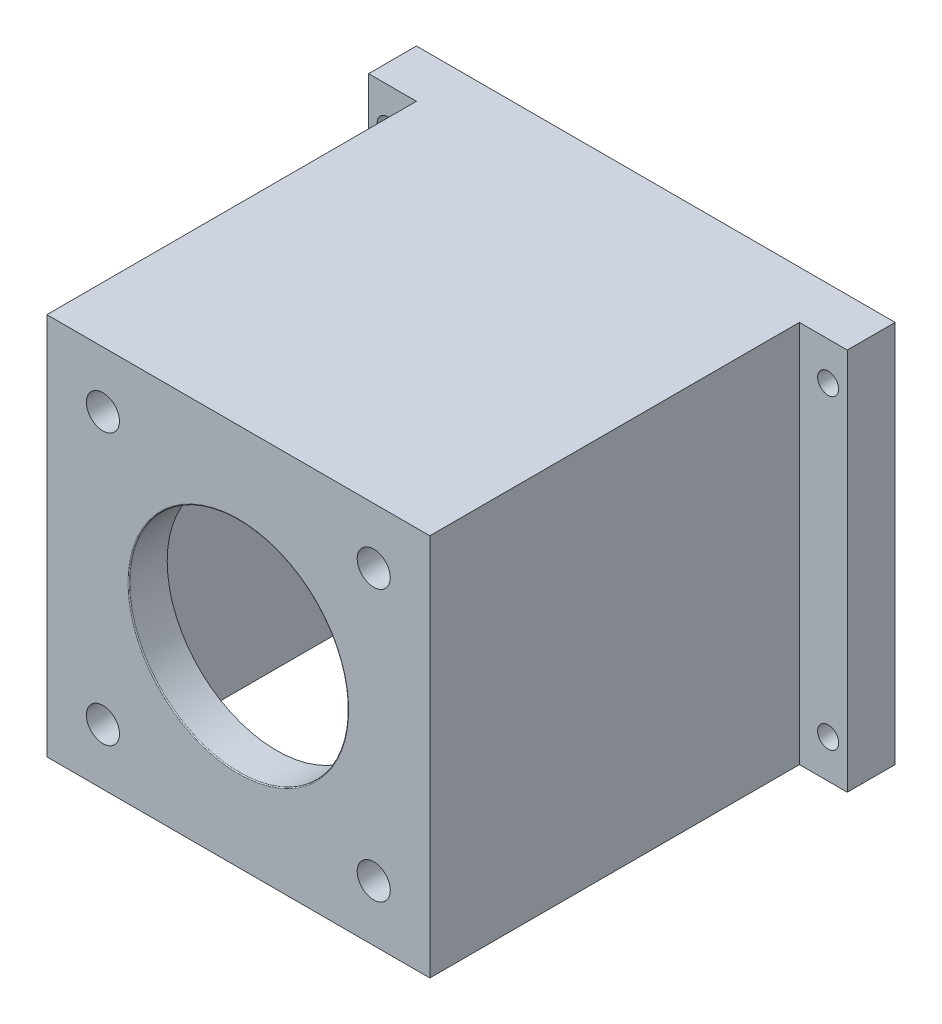
from build123d import *

# Parameters (mm, degrees)
SKETCH_1_W           = 200
SKETCH_1_H           = 200
EXTRUDE_1_DEPTH      = 191
SHELL_1_T            = -20
SKETCH_4_5_R         = 51
CUT_EXTRUDE_6_DEPTH  = 191
SKETCH_4_R           = 8.642247924
CUT_EXTRUDE_7_DEPTH  = 50
SKETCH_4_10_R        = 57.15
CUT_EXTRUDE_9_DEPTH  = 50
CUT_EXTRUDE_START    = -171
SKETCH_4_11_R        = 4
CUT_EXTRUDE_10_DEPTH = 50
SKETCH_9_W           = 200
SKETCH_9_H           = 200
EXTRUDE_3_DEPTH      = 32
SKETCH_10_R          = 72.5
CUT_EXTRUDE_11_DEPTH = 2
SKETCH_11_R          = 72
CUT_EXTRUDE_13_DEPTH = 30
SKETCH_11_3_W        = 200
SKETCH_11_3_H        = 200
SKETCH_11_3_R        = 77
CUT_EXTRUDE_14_DEPTH = 5
SKETCH_14_W          = 25
SKETCH_14_H          = 200
EXTRUDE_4_DEPTH      = 25
SKETCH_15_R          = 5.5
CUT_EXTRUDE_15_DEPTH = 25
SKETCH_16_R          = 3
CUT_EXTRUDE_16_DEPTH = 20
FILLET_1_R           = 0.5


with BuildPart() as part:
    # 草图1 → 凸台-拉伸1 (new body)
    with BuildSketch(Plane.XY):
        with Locations((43.238558972, -58.914961101)):
            Rectangle(SKETCH_1_W, SKETCH_1_H)
    extrude(amount=EXTRUDE_1_DEPTH)

    # 抽壳1
    shell_1_openings = [part.faces().sort_by_distance(p)[0] for p in [
        (43.238558972, -158.914961101, 95.5),
    ]]
    offset(amount=SHELL_1_T, openings=shell_1_openings, kind=Kind.INTERSECTION)

    # 草图4<5> → 切除-拉伸6 (cut)
    with BuildSketch(Plane.XY.offset(191)):
        with Locations((43.238558972, -58.914961101)):
            Circle(SKETCH_4_5_R)
    extrude(amount=-CUT_EXTRUDE_6_DEPTH, mode=Mode.SUBTRACT)

    # 草图4 → 切除-拉伸7 (cut)
    with BuildSketch(Plane.XY.offset(191)):
        with Locations((-27.472119147, 11.795717018)):
            Circle(SKETCH_4_R)
        with Locations((113.949237091, 11.795717018)):
            Circle(SKETCH_4_R)
        with Locations((113.949237091, -129.625639219)):
            Circle(SKETCH_4_R)
        with Locations((-27.472119147, -129.625639219)):
            Circle(SKETCH_4_R)
    extrude(amount=-CUT_EXTRUDE_7_DEPTH, mode=Mode.SUBTRACT)

    # 草图4<10> → 切除-拉伸9 (cut)
    with BuildSketch(Plane.XY.offset(191)):
        with Locations((43.238558972, -58.914961101)):
            Circle(SKETCH_4_10_R)
    extrude(amount=-CUT_EXTRUDE_9_DEPTH, mode=Mode.SUBTRACT)

    # 草图4<11> → 切除-拉伸10 (cut)
    with BuildSketch(Plane.XY.offset(191).offset(CUT_EXTRUDE_START)):
        with Locations(Location((-17.761441028, -58.914961101, 0), (0, 0, 180))):
            Circle(SKETCH_4_11_R)
        with Locations(Location((12.738558972, -6.08741147, 0), (0, 0, 180))):
            Circle(SKETCH_4_11_R)
        with Locations(Location((73.738558972, -6.08741147, 0), (0, 0, 180))):
            Circle(SKETCH_4_11_R)
        with Locations(Location((104.238558972, -58.914961101, 0), (0, 0, 180))):
            Circle(SKETCH_4_11_R)
        with Locations(Location((73.738558972, -111.742510731, 0), (0, 0, 180))):
            Circle(SKETCH_4_11_R)
        with Locations(Location((12.738558972, -111.742510731, 0), (0, 0, 180))):
            Circle(SKETCH_4_11_R)
    extrude(amount=-CUT_EXTRUDE_10_DEPTH, mode=Mode.SUBTRACT)

    # 草图9 → 凸台-拉伸3 (add)
    with BuildSketch(Plane(origin=(0, 0, 0), x_dir=(-1, 0, 0), z_dir=(0, 0, -1))):
        with Locations((-43.238558972, -58.914961101)):
            Rectangle(SKETCH_9_W, SKETCH_9_H)
    extrude(amount=EXTRUDE_3_DEPTH)

    # 草图10 → 切除-拉伸11 (cut)
    with BuildSketch(Plane.XY):
        with Locations((43.238558972, -57.634762562)):
            Circle(SKETCH_10_R)
    extrude(amount=-CUT_EXTRUDE_11_DEPTH, mode=Mode.SUBTRACT)

    # 草图11 → 切除-拉伸13 (cut)
    with BuildSketch(Plane(origin=(0, 0, -32), x_dir=(-1, 0, 0), z_dir=(0, 0, -1))):
        with Locations((-43.238558972, -58.914961101)):
            Circle(SKETCH_11_R)
    extrude(amount=-CUT_EXTRUDE_13_DEPTH, mode=Mode.SUBTRACT)

    # 草图11<3> → 切除-拉伸14 (cut)
    with BuildSketch(Plane(origin=(0, 0, -32), x_dir=(-1, 0, 0), z_dir=(0, 0, -1))):
        with Locations((-43.238558972, -58.914961101)):
            Rectangle(SKETCH_11_3_W, SKETCH_11_3_H)
        with Locations((-43.238558972, -58.914961101)):
            Circle(SKETCH_11_3_R, mode=Mode.SUBTRACT)
    extrude(amount=-CUT_EXTRUDE_14_DEPTH, mode=Mode.SUBTRACT)

    # 草图14 → 凸台-拉伸4 (add)
    with BuildSketch(Plane(origin=(0, 0, -27), x_dir=(-1, 0, 0), z_dir=(0, 0, -1))):
        with Locations((-155.738558972, -58.914961101)):
            Rectangle(SKETCH_14_W, SKETCH_14_H)
        with Locations((69.261441028, -58.914961101)):
            Rectangle(SKETCH_14_W, SKETCH_14_H)
    extrude(amount=-EXTRUDE_4_DEPTH)

    # 草图15 → 切除-拉伸15 (cut)
    with BuildSketch(Plane.XY.offset(-2)):
        with Locations((-71.761441028, 21.085038899)):
            Circle(SKETCH_15_R)
        with Locations(Location((-71.761441028, -138.914961101, 0), (0, 0, 180))):
            Circle(SKETCH_15_R)
        with Locations((158.238558972, 21.085038899)):
            Circle(SKETCH_15_R)
        with Locations((158.238558972, -138.914961101)):
            Circle(SKETCH_15_R)
    extrude(amount=-CUT_EXTRUDE_15_DEPTH, mode=Mode.SUBTRACT)

    # 草图16 → 切除-拉伸16 (cut)
    with BuildSketch(Plane.XZ.offset(158.914961101)):
        with Locations((133.238558972, 181)):
            Circle(SKETCH_16_R)
        with Locations(Location((-46.761441028, 181, 0), (0, 0, 180))):
            Circle(SKETCH_16_R)
        with Locations((-46.761441028, -17)):
            Circle(SKETCH_16_R)
        with Locations((133.238558972, -17)):
            Circle(SKETCH_16_R)
    extrude(amount=-CUT_EXTRUDE_16_DEPTH, mode=Mode.SUBTRACT)

    # 圆角1
    fillet_1_edges = [part.edges().sort_by_distance(p)[0] for p in [
        (115.238558972, -58.914961101, -32),
        (120.238558972, -58.914961101, -32),
        (-13.911441028, -58.914961101, 191),
    ]]
    fillet(fillet_1_edges, radius=FILLET_1_R)


solid = part.part
